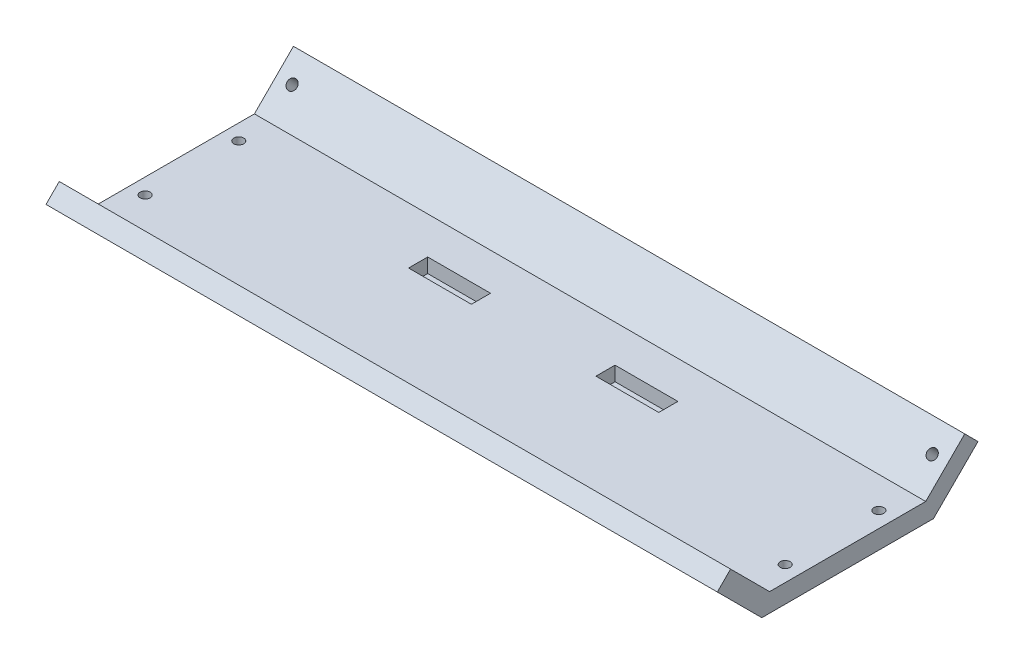
from build123d import *

# Parameters (mm, degrees)
MAIN_DEPTH                      = 107.5
F_3_0MM_DOWEL_HOLE2_D           = 3.2
F_3_0MM_DOWEL_HOLE2_ON_FACE_2_D = 3.2
F_3_0MM_DOWEL_HOLE2_ON_FACE_3_D = 3.2
F_3_0MM_DOWEL_HOLE2_ON_FACE_4_D = 3.2
SKETCH6_W                       = 20.125
SKETCH6_H                       = 6.125
SHELF_CUT_DEPTH                 = 116.995465651
SKETCH7_W                       = 20.125
SKETCH7_H                       = 6.125
BOSS_EXTRUDE1_DEPTH             = 1.4


with BuildPart() as part:
    # Sketch2 → Main (new, symmetric)
    with BuildSketch(Plane(origin=(0, 0, 0), x_dir=(0, 0, -1), z_dir=(1, 0, 0))):
        Polygon((-25, 0), (25, 0), (37.5, 12.5), (41.742640687, 8.257359313), (27.485281374, -6), (-27.485281374, -6), (-41.742640687, 8.257359313), (-37.5, 12.5), align=None)
    extrude(amount=MAIN_DEPTH, both=True)

    # Ø3.0mm Dowel Hole2 (through all)
    with Locations(Plane(origin=(-102.5, 7.071067812, -32.071067812), x_dir=(0, 0.707106781187, -0.707106781187), z_dir=(0, 0.707106781187, 0.707106781187))):
        with Locations((0, 0)):
            Hole(F_3_0MM_DOWEL_HOLE2_D / 2)

    # Ø3.0mm Dowel Hole2 on face 2 (through all)
    with Locations(Plane(origin=(-102.5, 0, -15), x_dir=(0, 0, 1), z_dir=(0, 1, 0))):
        with Locations((0, 0), (30, 0), (30, 205), (0, 205)):
            Hole(F_3_0MM_DOWEL_HOLE2_ON_FACE_2_D / 2)

    # Ø3.0mm Dowel Hole2 on face 3 (through all)
    with Locations(Plane(origin=(-102.5, 7.071067812, 32.071067812), x_dir=(0, -0.707106781187, -0.707106781187), z_dir=(0, 0.707106781187, -0.707106781187))):
        with Locations((0, 0), (0, -205)):
            Hole(F_3_0MM_DOWEL_HOLE2_ON_FACE_3_D / 2)

    # Ø3.0mm Dowel Hole2 on face 4 (through all)
    with Locations(Plane(origin=(102.5, 7.071067812, -32.071067812), x_dir=(0, 0.707106781187, -0.707106781187), z_dir=(0, 0.707106781187, 0.707106781187))):
        with Locations((0, 0)):
            Hole(F_3_0MM_DOWEL_HOLE2_ON_FACE_4_D / 2)

    # Sketch6 → Shelf cut (cut, through all)
    with BuildSketch(Plane(origin=(0, 0, 0), x_dir=(1, 0, 0), z_dir=(0, 1, 0))):
        with Locations((30, 10)):
            Rectangle(SKETCH6_W, SKETCH6_H)
        with Locations((-30, 10)):
            Rectangle(SKETCH6_W, SKETCH6_H)
    extrude(amount=-SHELF_CUT_DEPTH, mode=Mode.SUBTRACT)

    # Sketch7 → Boss-Extrude1 (add)
    with BuildSketch(Plane.XZ.offset(6)):
        with Locations((30, -10)):
            Rectangle(SKETCH7_W, SKETCH7_H)
        with Locations((-30, -10)):
            Rectangle(SKETCH7_W, SKETCH7_H)
    extrude(amount=-BOSS_EXTRUDE1_DEPTH)


solid = part.part
